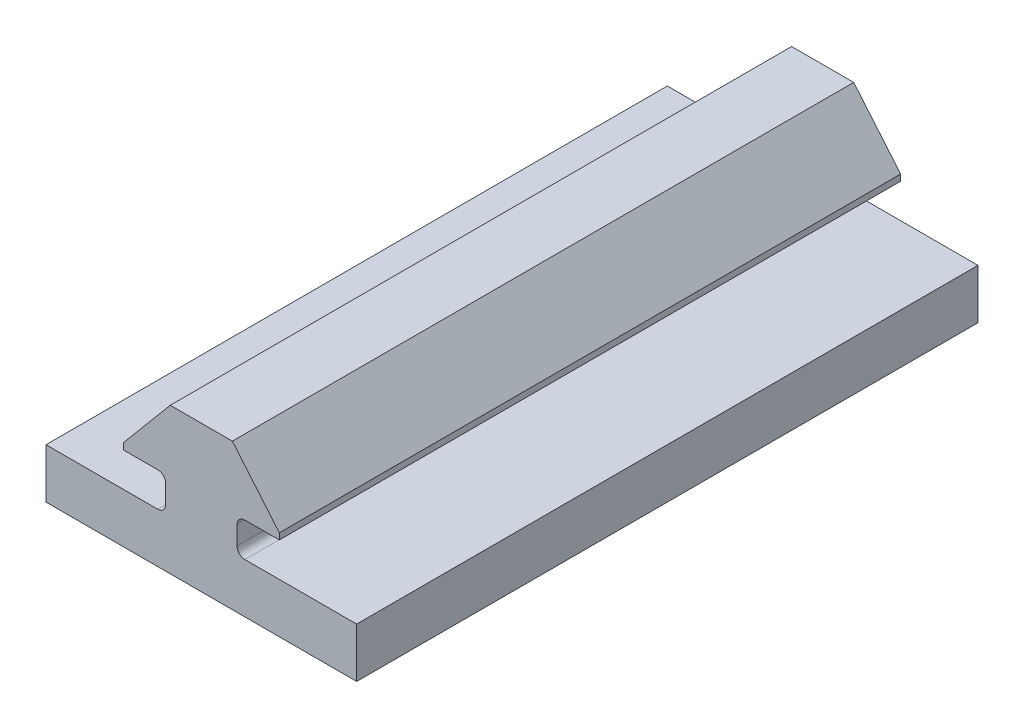
from build123d import *

# Parameters (mm, degrees)
BOSS_EXTRUDE6_DEPTH = 50.8


with BuildPart() as part:
    # Sketch1 → Boss-Extrude6 (new body)
    with BuildSketch(Plane(origin=(0, 0, -3683), x_dir=(-1, 0, 0), z_dir=(0, 0, -1))):
        with BuildLine():
            Line((12.7, 4.064), (3.556, 4.064))
            ThreePointArc((3.556, 4.064), (3.106987194, 4.249987194), (2.921, 4.699))
            Line((2.921, 4.699), (2.921, 6.223))
            ThreePointArc((2.921, 6.223), (3.106987194, 6.672012806), (3.556, 6.858))
            Line((3.556, 6.858), (6.376363549, 6.858))
            Line((6.376363549, 6.858), (6.376363549, 7.365999958))
            Line((6.376363549, 7.365999958), (2.54, 11.938))
            Line((2.54, 11.938), (-2.54, 11.938))
            Line((-2.54, 11.938), (-6.376363549, 7.365999958))
            Line((-6.376363549, 7.365999958), (-6.376363549, 6.858))
            Line((-6.376363549, 6.858), (-3.556, 6.858))
            ThreePointArc((-3.556, 6.858), (-3.106987194, 6.672012806), (-2.921, 6.223))
            Line((-2.921, 6.223), (-2.921, 4.699))
            ThreePointArc((-2.921, 4.699), (-3.106987194, 4.249987194), (-3.556, 4.064))
            Line((-3.556, 4.064), (-12.7, 4.064))
            Line((-12.7, 4.064), (-12.7, 0))
            Line((-12.7, 0), (12.7, 0))
            Line((12.7, 0), (12.7, 4.064))
        make_face()
    extrude(amount=BOSS_EXTRUDE6_DEPTH)


solid = part.part
